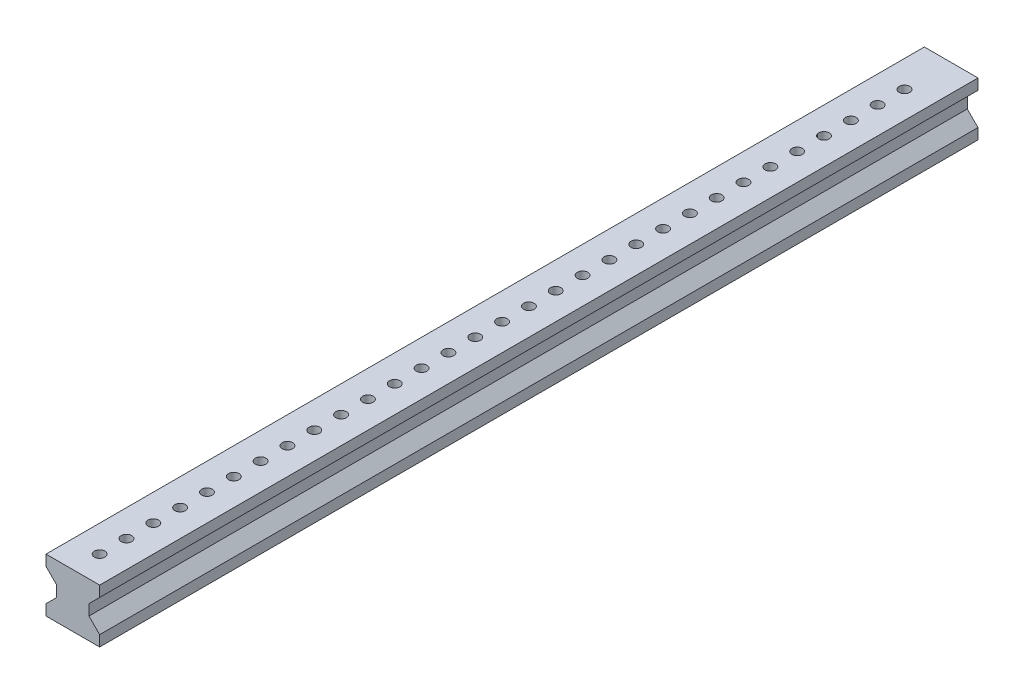
from build123d import *

# Parameters (mm, degrees)
BOSS_EXTRUDE1_DEPTH = 415.798
SKETCH3_R           = 2.5
CUT_EXTRUDE1_DEPTH  = 25.4


with BuildPart() as part:
    # Sketch1 → Boss-Extrude1 (new body)
    with BuildSketch(Plane.XY):
        Polygon((12.7, 12.7), (-12.7, 12.7), (-12.7, 7.62), (-7.62, 2.54), (-7.62, -2.54), (-12.7, -7.62), (-12.7, -12.7), (12.7, -12.7), (12.7, -7.62), (7.62, -2.54), (7.62, 2.54), (12.7, 7.62), align=None)
    extrude(amount=BOSS_EXTRUDE1_DEPTH)

    # Sketch3 → Cut-Extrude1 (cut)
    with BuildSketch(Plane(origin=(0, 12.7, 0), x_dir=(1, 0, 0), z_dir=(0, 1, 0))):
        with Locations(Location((0, -403.098, 0), (0, 0, 270))):
            Circle(SKETCH3_R)
        with Locations(Location((0, -390.398, 0), (0, 0, 270))):
            Circle(SKETCH3_R)
        with Locations(Location((0, -377.698, 0), (0, 0, 270))):
            Circle(SKETCH3_R)
        with Locations(Location((0, -364.998, 0), (0, 0, 270))):
            Circle(SKETCH3_R)
        with Locations(Location((0, -352.298, 0), (0, 0, 270))):
            Circle(SKETCH3_R)
        with Locations(Location((0, -339.598, 0), (0, 0, 270))):
            Circle(SKETCH3_R)
        with Locations(Location((0, -326.898, 0), (0, 0, 270))):
            Circle(SKETCH3_R)
        with Locations(Location((0, -314.198, 0), (0, 0, 270))):
            Circle(SKETCH3_R)
        with Locations(Location((0, -301.498, 0), (0, 0, 270))):
            Circle(SKETCH3_R)
        with Locations(Location((0, -288.798, 0), (0, 0, 270))):
            Circle(SKETCH3_R)
        with Locations(Location((0, -276.098, 0), (0, 0, 270))):
            Circle(SKETCH3_R)
        with Locations(Location((0, -263.398, 0), (0, 0, 270))):
            Circle(SKETCH3_R)
        with Locations(Location((0, -250.698, 0), (0, 0, 270))):
            Circle(SKETCH3_R)
        with Locations(Location((0, -237.998, 0), (0, 0, 270))):
            Circle(SKETCH3_R)
        with Locations(Location((0, -225.298, 0), (0, 0, 270))):
            Circle(SKETCH3_R)
        with Locations(Location((0, -212.598, 0), (0, 0, 270))):
            Circle(SKETCH3_R)
        with Locations(Location((0, -199.898, 0), (0, 0, 270))):
            Circle(SKETCH3_R)
        with Locations(Location((0, -187.198, 0), (0, 0, 270))):
            Circle(SKETCH3_R)
        with Locations(Location((0, -174.498, 0), (0, 0, 270))):
            Circle(SKETCH3_R)
        with Locations(Location((0, -161.798, 0), (0, 0, 270))):
            Circle(SKETCH3_R)
        with Locations(Location((0, -149.098, 0), (0, 0, 270))):
            Circle(SKETCH3_R)
        with Locations(Location((0, -136.398, 0), (0, 0, 270))):
            Circle(SKETCH3_R)
        with Locations(Location((0, -123.698, 0), (0, 0, 270))):
            Circle(SKETCH3_R)
        with Locations(Location((0, -110.998, 0), (0, 0, 270))):
            Circle(SKETCH3_R)
        with Locations(Location((0, -98.298, 0), (0, 0, 270))):
            Circle(SKETCH3_R)
        with Locations(Location((0, -85.598, 0), (0, 0, 270))):
            Circle(SKETCH3_R)
        with Locations(Location((0, -72.898, 0), (0, 0, 270))):
            Circle(SKETCH3_R)
        with Locations(Location((0, -60.198, 0), (0, 0, 270))):
            Circle(SKETCH3_R)
        with Locations(Location((0, -47.498, 0), (0, 0, 270))):
            Circle(SKETCH3_R)
        with Locations(Location((0, -34.798, 0), (0, 0, 270))):
            Circle(SKETCH3_R)
        with Locations(Location((0, -22.098, 0), (0, 0, 270))):
            Circle(SKETCH3_R)
    extrude(amount=-CUT_EXTRUDE1_DEPTH, mode=Mode.SUBTRACT)


solid = part.part
